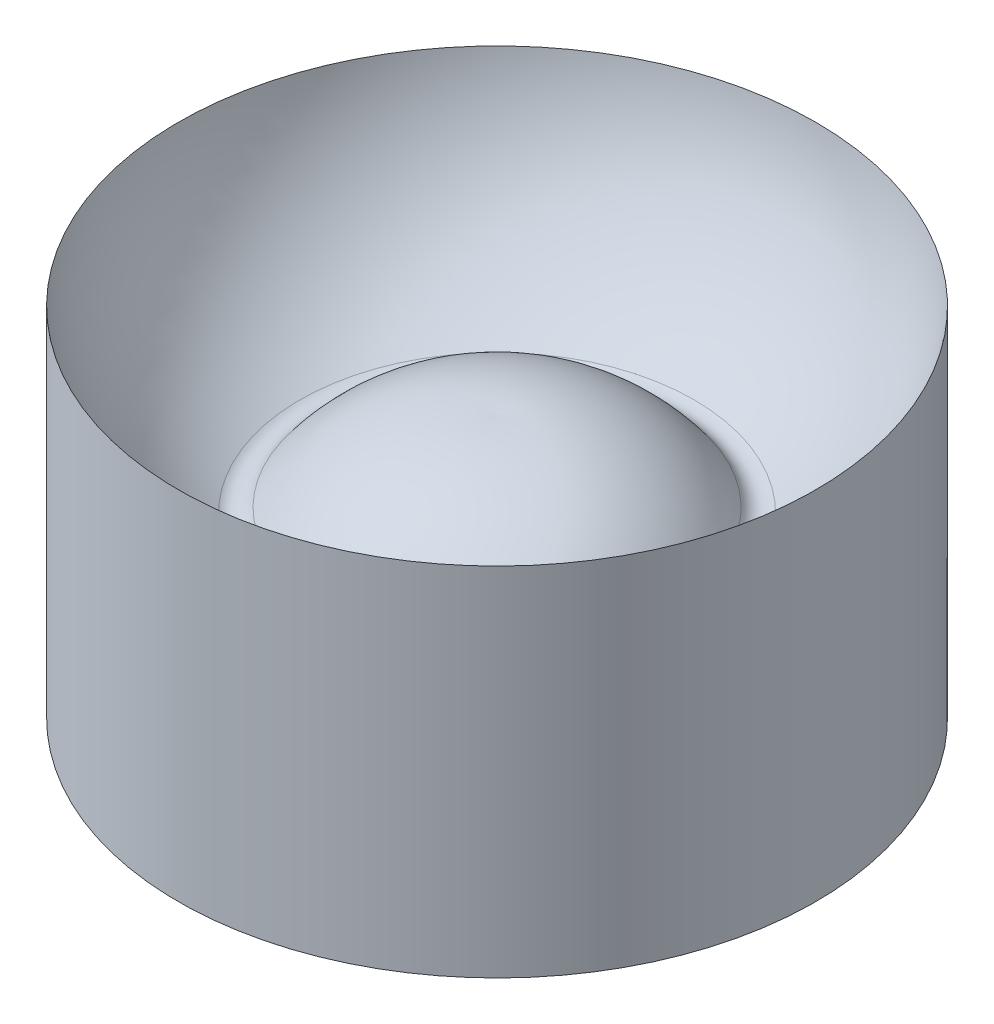
from build123d import *

# Parameters (mm, degrees)
BOSS_EXTRUDE1_DEPTH = 17
CUT_EXTRUDE1_DEPTH  = 7


with BuildPart() as part:
    # Sketch1 → Revolve1 (revolve)
    with BuildSketch(Plane.XY, mode=Mode.PRIVATE) as revolve1_sk:
        with BuildLine():
            ThreePointArc((31.477739174, 1.289033786), (44.553939615, 13.368129979), (50.9, 30))
            Line((50.9, 30), (50.9, 0))
            Line((50.9, 0), (50.9, -7))
            Line((50.9, -7), (50.9, -27))
            Line((50.9, -27), (47.9, -27))
            Line((47.9, -27), (47.9, -7))
            Line((47.9, -7), (0, -7))
            Line((0, -7), (0, 0))
            Line((0, 0), (0, 15))
            ThreePointArc((0, 15), (15.444355802, 12.116315948), (27.574800041, 2.13152339))
            ThreePointArc((27.574800041, 2.13152339), (29.365754755, 0.96667333), (31.477739174, 1.289033786))
        make_face()
    revolve(revolve1_sk.sketch.rotate(Axis((0, 0, 0), (0, 1, 0)), 90), axis=Axis((0, 0, 0), (0, 1, 0)))

    # Sketch2 → Boss-Extrude1 (add)
    with BuildSketch(Plane.XZ.offset(7)):
        with BuildLine():
            Line((7.764571353, -28.977774789), (9.576304669, -35.739255573))
            ThreePointArc((9.576304669, -35.739255573), (0, -37), (-9.576304669, -35.739255573))
            Line((-9.576304669, -35.739255573), (-7.764571353, -28.977774789))
            ThreePointArc((-7.764571353, -28.977774789), (0, -30), (7.764571353, -28.977774789))
        make_face()
        with BuildLine():
            Line((28.977774789, 7.764571353), (35.739255573, 9.576304669))
            ThreePointArc((35.739255573, 9.576304669), (37, 0), (35.739255573, -9.576304669))
            Line((35.739255573, -9.576304669), (28.977774789, -7.764571353))
            ThreePointArc((28.977774789, -7.764571353), (30, 0), (28.977774789, 7.764571353))
        make_face()
        with BuildLine():
            Line((-28.977774789, -7.764571353), (-35.739255573, -9.576304669))
            ThreePointArc((-35.739255573, -9.576304669), (-37, 0), (-35.739255573, 9.576304669))
            Line((-35.739255573, 9.576304669), (-28.977774789, 7.764571353))
            ThreePointArc((-28.977774789, 7.764571353), (-30, 0), (-28.977774789, -7.764571353))
        make_face()
        with BuildLine():
            Line((-7.764571353, 28.977774789), (-9.576304669, 35.739255573))
            ThreePointArc((-9.576304669, 35.739255573), (0, 37), (9.576304669, 35.739255573))
            Line((9.576304669, 35.739255573), (7.764571353, 28.977774789))
            ThreePointArc((7.764571353, 28.977774789), (0, 30), (-7.764571353, 28.977774789))
        make_face()
    extrude(amount=BOSS_EXTRUDE1_DEPTH)

    # Sketch3 → Cut-Extrude1 (cut)
    with BuildSketch(Plane(origin=(0, -12, 0), x_dir=(-1, 0, 0), z_dir=(0, -1, 0))):
        with BuildLine():
            Line((3.777949646, -30.768930701), (4.387296363, -35.731661459))
            ThreePointArc((4.387296363, -35.731661459), (-2.511233055, -35.912305809), (-9.317485624, -34.773329746))
            Line((-9.317485624, -34.773329746), (-8.023390398, -29.943700615))
            ThreePointArc((-8.023390398, -29.943700615), (-2.162450686, -30.924485558), (3.777949646, -30.768930701))
        make_face()
        with BuildLine():
            Line((30.768930701, 3.777949646), (35.731661459, 4.387296363))
            ThreePointArc((35.731661459, 4.387296363), (35.912305809, -2.511233055), (34.773329746, -9.317485624))
            Line((34.773329746, -9.317485624), (29.943700615, -8.023390398))
            ThreePointArc((29.943700615, -8.023390398), (30.924485558, -2.162450686), (30.768930701, 3.777949646))
        make_face()
        with BuildLine():
            Line((-30.768930701, -3.777949646), (-35.731661459, -4.387296363))
            ThreePointArc((-35.731661459, -4.387296363), (-35.912305809, 2.511233055), (-34.773329746, 9.317485624))
            Line((-34.773329746, 9.317485624), (-29.943700615, 8.023390398))
            ThreePointArc((-29.943700615, 8.023390398), (-30.924485558, 2.162450686), (-30.768930701, -3.777949646))
        make_face()
        with BuildLine():
            Line((-3.777949646, 30.768930701), (-4.387296363, 35.731661459))
            ThreePointArc((-4.387296363, 35.731661459), (2.511233055, 35.912305809), (9.317485624, 34.773329746))
            Line((9.317485624, 34.773329746), (8.023390398, 29.943700615))
            ThreePointArc((8.023390398, 29.943700615), (2.162450686, 30.924485558), (-3.777949646, 30.768930701))
        make_face()
    extrude(amount=CUT_EXTRUDE1_DEPTH, mode=Mode.SUBTRACT)


solid = part.part
